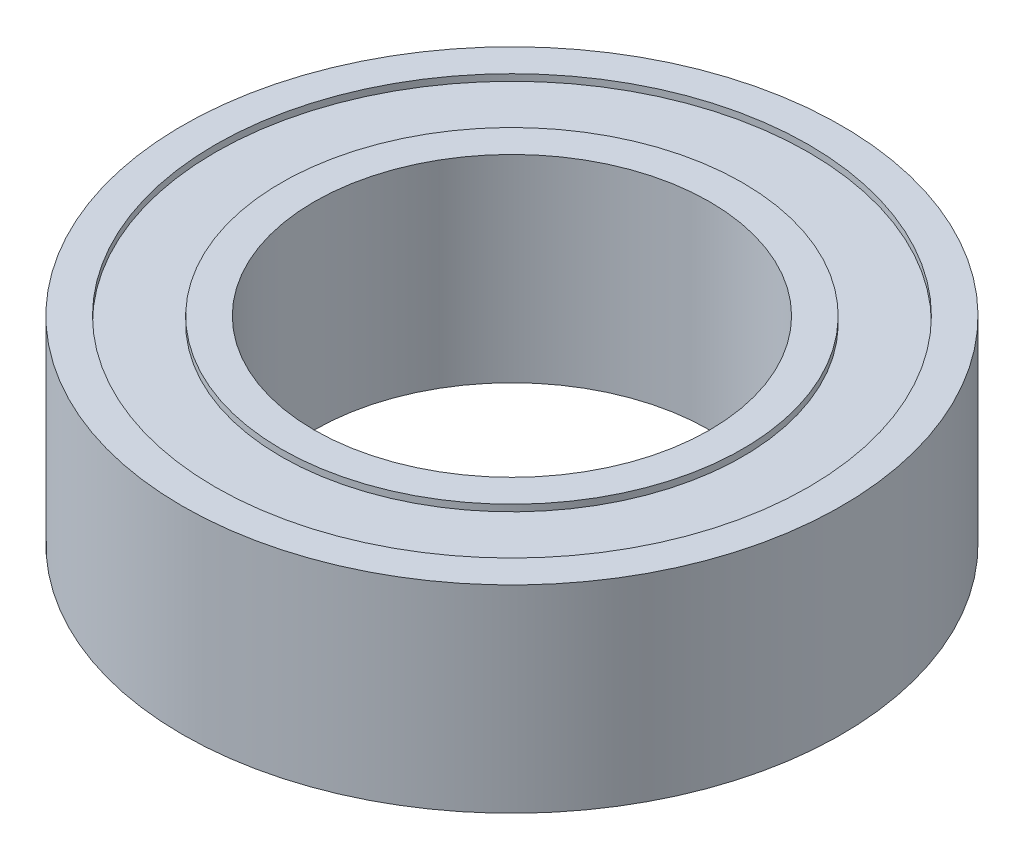
from build123d import *

# Parameters (mm, degrees)
SKETCH_1_R          = 5
EXTRUDE_1_DEPTH     = 3
CUT_EXTRUDE_1_REACH = 9.681
SKETCH_2_R          = 3
SKETCH_3_R          = 4.5
SKETCH_3_R_2        = 3.5
CUT_EXTRUDE_2_DEPTH = 0.1
CUT_EXTRUDE_START   = -0.1
SKETCH_4_R          = 4.5
SKETCH_4_R_2        = 3.5
CUT_EXTRUDE_3_DEPTH = 0.1


with BuildPart() as part:
    # 草图1 → 凸台-拉伸1 (new body)
    with BuildSketch(Plane(origin=(0, 0, 0), x_dir=(1, 0, 0), z_dir=(0, 1, 0))):
        with Locations(Location((0, 0, 0), (0, 0, 270))):
            Circle(SKETCH_1_R)
    extrude(amount=EXTRUDE_1_DEPTH)

    # 草图2 → 切除-拉伸1 (cut, up to next)
    with BuildSketch(Plane(origin=(0, 3, 0), x_dir=(1, 0, 0), z_dir=(0, 1, 0)), mode=Mode.PRIVATE) as cut_extrude_1_sk1:
        with Locations(Location((0, 0, 0), (0, 0, 270))):
            Circle(SKETCH_2_R)
    cut_extrude_1_tool1 = extrude(cut_extrude_1_sk1.sketch, amount=-CUT_EXTRUDE_1_REACH, mode=Mode.PRIVATE) & part.part
    add(cut_extrude_1_tool1.solids().sort_by_distance((0, 3, 0))[0], mode=Mode.SUBTRACT)

    # 草图3 → 切除-拉伸2 (cut)
    with BuildSketch(Plane(origin=(0, 3, 0), x_dir=(1, 0, 0), z_dir=(0, 1, 0))):
        with Locations(Location((0, 0, 0), (0, 0, 270))):
            Circle(SKETCH_3_R)
        with Locations(Location((0, 0, 0), (0, 0, 270))):
            Circle(SKETCH_3_R_2, mode=Mode.SUBTRACT)
    extrude(amount=-CUT_EXTRUDE_2_DEPTH, mode=Mode.SUBTRACT)

    # 草图4 → 切除-拉伸3 (cut)
    with BuildSketch(Plane.XZ.offset(CUT_EXTRUDE_START)):
        with Locations(Location((0, 0, 0), (0, 0, 90))):
            Circle(SKETCH_4_R)
        with Locations(Location((0, 0, 0), (0, 0, 90))):
            Circle(SKETCH_4_R_2, mode=Mode.SUBTRACT)
    extrude(amount=CUT_EXTRUDE_3_DEPTH, mode=Mode.SUBTRACT)


solid = part.part
